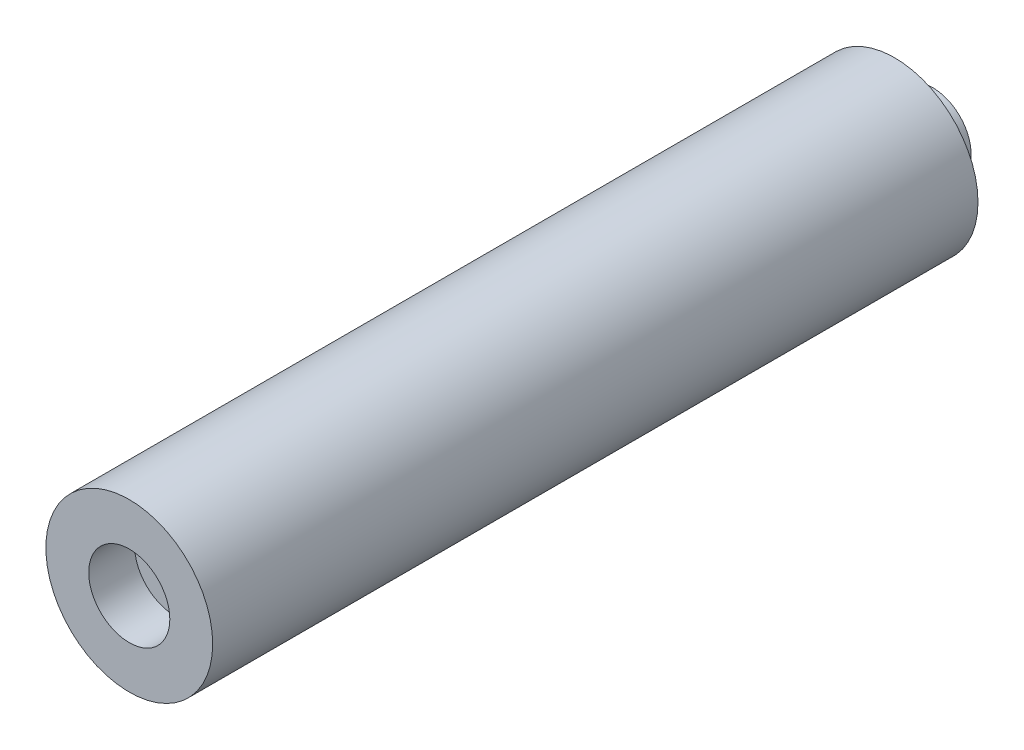
from build123d import *

# Parameters (mm, degrees)
SKETCH1_R           = 5.45
BOSS_EXTRUDE1_DEPTH = 50
SKETCH6_R           = 2.5
BOSS_EXTRUDE2_DEPTH = 2.5
SKETCH7_R           = 2.65
CUT_EXTRUDE1_DEPTH  = 3


with BuildPart() as part:
    # Sketch1 → Boss-Extrude1 (new body)
    with BuildSketch(Plane.XY):
        Circle(SKETCH1_R)
    extrude(amount=BOSS_EXTRUDE1_DEPTH)

    # Sketch6 → Boss-Extrude2 (add)
    with BuildSketch(Plane(origin=(0, 0, 0), x_dir=(-1, 0, 0), z_dir=(0, 0, -1))):
        Circle(SKETCH6_R)
    extrude(amount=BOSS_EXTRUDE2_DEPTH)

    # Sketch7 → Cut-Extrude1 (cut)
    with BuildSketch(Plane.XY.offset(50)):
        Circle(SKETCH7_R)
    extrude(amount=-CUT_EXTRUDE1_DEPTH, mode=Mode.SUBTRACT)


solid = part.part
